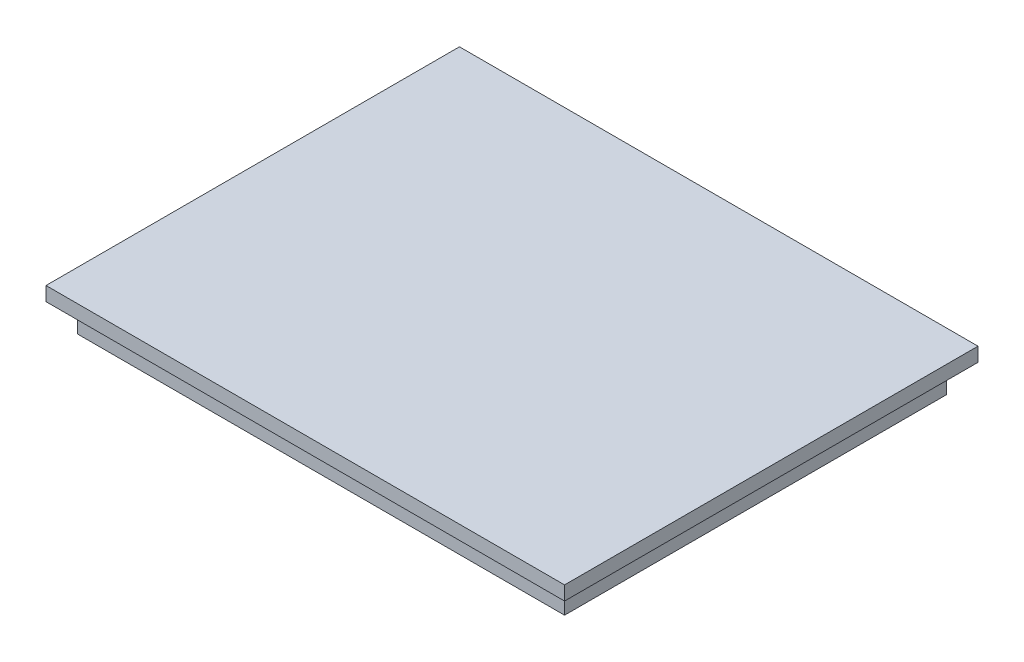
from build123d import *

# Parameters (mm, degrees)
SKETCH1_W           = 74
SKETCH1_H           = 59
BOSS_EXTRUDE1_DEPTH = 2
SKETCH2_W           = 69.5
SKETCH2_H           = 54.5
SKETCH2_W_2         = 65.5
SKETCH2_H_2         = 50.5
BOSS_EXTRUDE2_DEPTH = 4


with BuildPart() as part:
    # Sketch1 → Boss-Extrude1 (new body)
    with BuildSketch(Plane(origin=(0, 0, 0), x_dir=(1, 0, 0), z_dir=(0, 1, 0))):
        Rectangle(SKETCH1_W, SKETCH1_H)
    extrude(amount=BOSS_EXTRUDE1_DEPTH)

    # Sketch2 → Boss-Extrude2 (add)
    with BuildSketch(Plane.XZ):
        Rectangle(SKETCH2_W, SKETCH2_H)
        Rectangle(SKETCH2_W_2, SKETCH2_H_2, mode=Mode.SUBTRACT)
    extrude(amount=BOSS_EXTRUDE2_DEPTH)


solid = part.part
